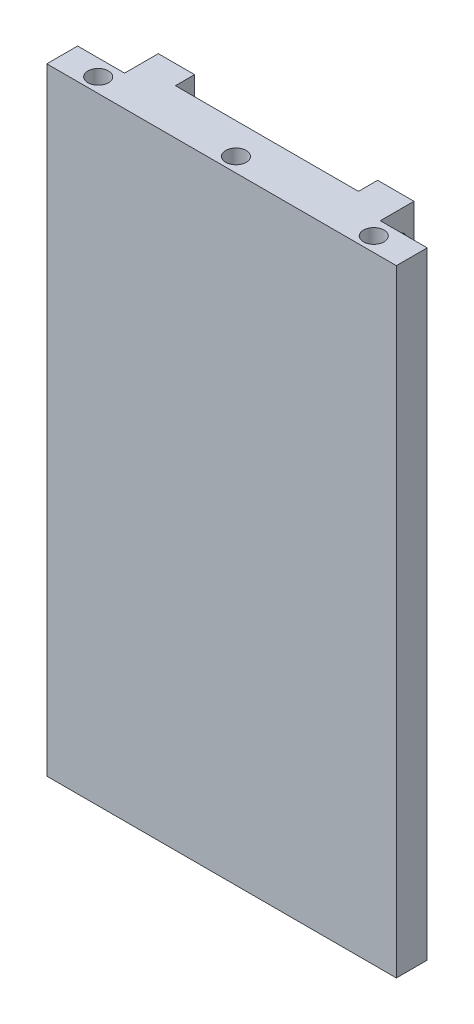
from build123d import *

# Parameters (mm, degrees)
BOSS_EXTRUDE1_DEPTH = 300
SKETCH6_R           = 5
CUT_EXTRUDE2_DEPTH  = 17.67
SKETCH8_R           = 5
CUT_EXTRUDE3_DEPTH  = 10
CUT_EXTRUDE4_START  = -10
SKETCH9_R           = 5
CUT_EXTRUDE4_DEPTH  = 10


with BuildPart() as part:
    # Sketch2 → Boss-Extrude1 (new body)
    with BuildSketch(Plane(origin=(0, 0, 0), x_dir=(1, 0, 0), z_dir=(0, 1, 0))):
        Polygon((0, 0), (170, 0), (170, 15), (147.17, 15), (147.17, 31.396582403), (129.5, 31.396582403), (129.5, 22.061582403), (40.5, 22.061582403), (40.5, 31.396582403), (22.83, 31.396582403), (22.83, 15), (0, 15), align=None)
    extrude(amount=BOSS_EXTRUDE1_DEPTH)

    # Sketch6 → Cut-Extrude2 (cut)
    with BuildSketch(Plane(origin=(147.17, 0, 0), x_dir=(0, 0, -1), z_dir=(1, 0, 0))):
        with Locations((23.1975, 285.170960777)):
            Circle(SKETCH6_R)
        with Locations((23.1975, 230.170960777)):
            Circle(SKETCH6_R)
        with Locations((23.1975, 175.170960777)):
            Circle(SKETCH6_R)
        with Locations((23.1975, 120.170960777)):
            Circle(SKETCH6_R)
        with Locations((23.1975, 65.170960777)):
            Circle(SKETCH6_R)
        with Locations((23.1975, 10.170960777)):
            Circle(SKETCH6_R)
    cut_extrude2 = extrude(amount=-CUT_EXTRUDE2_DEPTH, mode=Mode.SUBTRACT)

    # Mirror1: Cut-Extrude2 across plane
    add(cut_extrude2.mirror(Plane.ZY.offset(-85)), mode=Mode.SUBTRACT)

    # Sketch8 → Cut-Extrude3 (cut)
    with BuildSketch(Plane(origin=(0, 300, 0), x_dir=(1, 0, 0), z_dir=(0, 1, 0))):
        with Locations((152, 7.003164806)):
            Circle(SKETCH8_R)
        with Locations((85, 7.003164806)):
            Circle(SKETCH8_R)
        with Locations((18, 7.003164806)):
            Circle(SKETCH8_R)
    extrude(amount=-CUT_EXTRUDE3_DEPTH, mode=Mode.SUBTRACT)

    # Sketch9 → Cut-Extrude4 (cut)
    with BuildSketch(Plane.XZ.offset(CUT_EXTRUDE4_START)):
        with Locations((18, -7.003164806)):
            Circle(SKETCH9_R)
        with Locations((85, -7.003164806)):
            Circle(SKETCH9_R)
        with Locations((152, -7.003164806)):
            Circle(SKETCH9_R)
    extrude(amount=CUT_EXTRUDE4_DEPTH, mode=Mode.SUBTRACT)


solid = part.part
